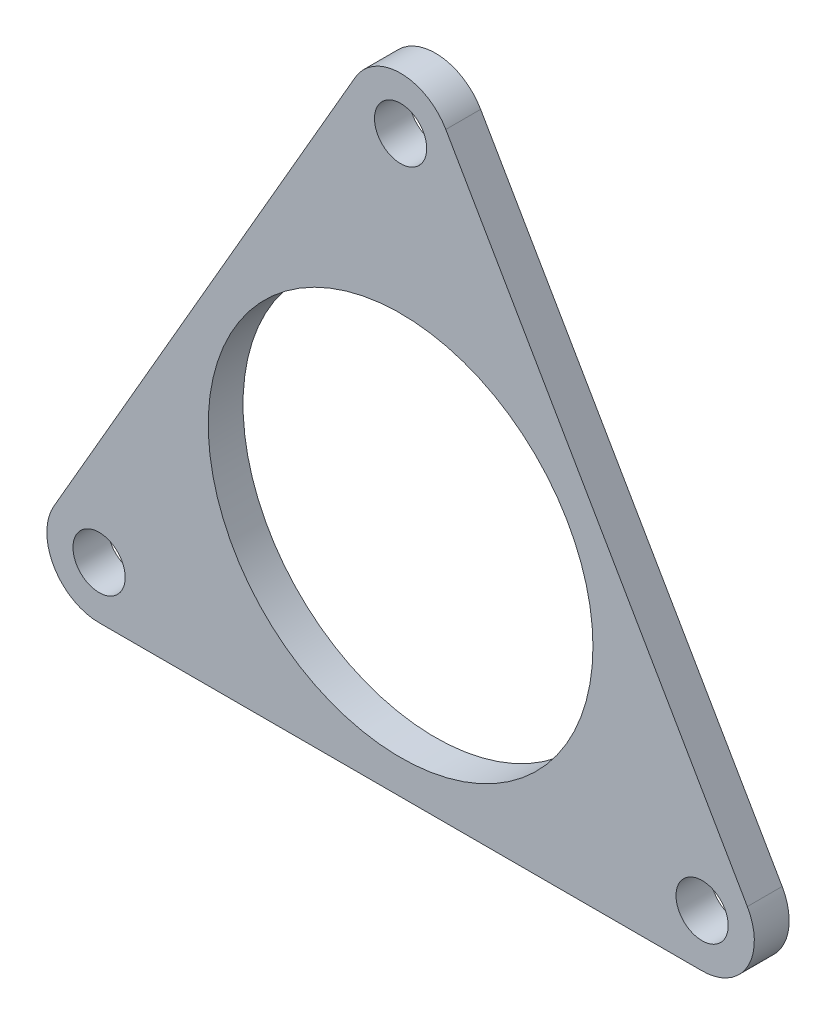
from build123d import *

# Parameters (mm, degrees)
SKETCH_1_R      = 1.5
SKETCH_1_R_2    = 11.05
EXTRUDE_1_DEPTH = 2


with BuildPart() as part:
    # 草图1 → 凸台-拉伸1 (new body)
    with BuildSketch(Plane.XY):
        with BuildLine():
            Line((-2.598076211, 21.5), (-19.918584287, -8.5))
            ThreePointArc((-19.918584287, -8.5), (-19.918584287, -11.5), (-17.320508076, -13))
            Line((-17.320508076, -13), (17.320508076, -13))
            ThreePointArc((17.320508076, -13), (19.918584287, -11.5), (19.918584287, -8.5))
            Line((19.918584287, -8.5), (2.598076211, 21.5))
            ThreePointArc((2.598076211, 21.5), (0, 23), (-2.598076211, 21.5))
        make_face()
        with Locations((-17.320508076, -10)):
            Circle(SKETCH_1_R, mode=Mode.SUBTRACT)
        with Locations((0, 20)):
            Circle(SKETCH_1_R, mode=Mode.SUBTRACT)
        with Locations((17.320508076, -10)):
            Circle(SKETCH_1_R, mode=Mode.SUBTRACT)
        Circle(SKETCH_1_R_2, mode=Mode.SUBTRACT)
    extrude(amount=EXTRUDE_1_DEPTH)


solid = part.part
